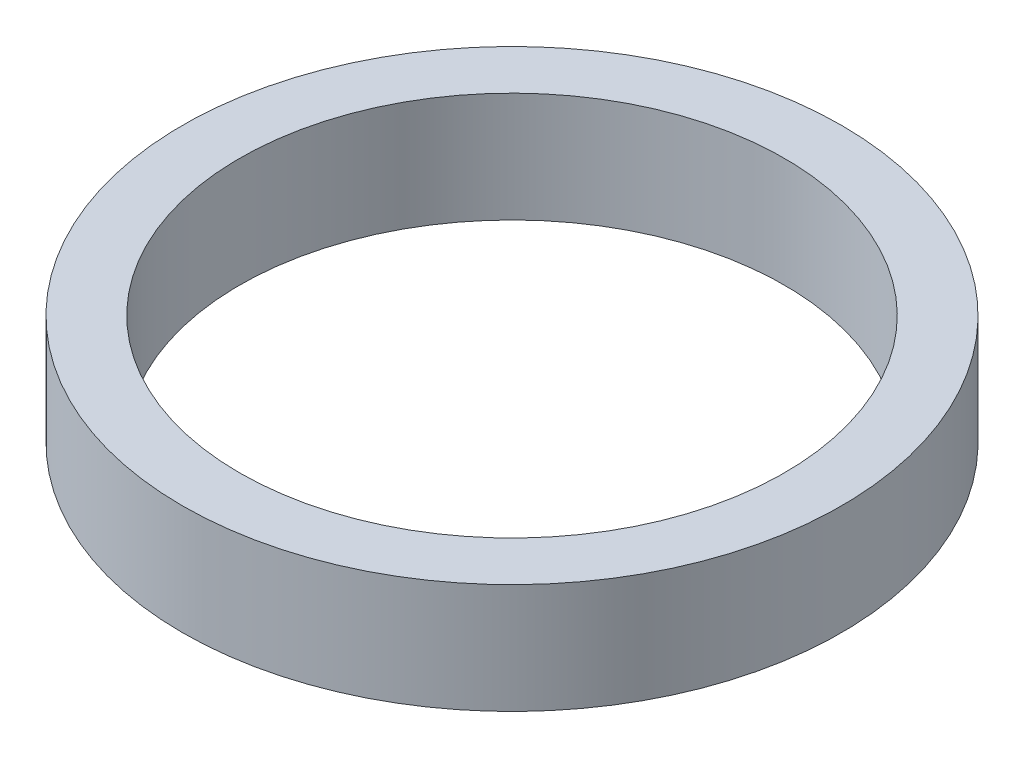
from build123d import *

# Parameters (mm, degrees)
SKETCH1_R           = 3.75
SKETCH1_R_2         = 3.1
BOSS_EXTRUDE1_DEPTH = 1.25


with BuildPart() as part:
    # Sketch1 → Boss-Extrude1 (new body)
    with BuildSketch(Plane(origin=(0, 0, 0), x_dir=(1, 0, 0), z_dir=(0, 1, 0))):
        with Locations(Location((0, 0, 0), (0, 0, 270))):
            Circle(SKETCH1_R)
        with Locations(Location((0, 0, 0), (0, 0, 270))):
            Circle(SKETCH1_R_2, mode=Mode.SUBTRACT)
    extrude(amount=BOSS_EXTRUDE1_DEPTH)


solid = part.part
